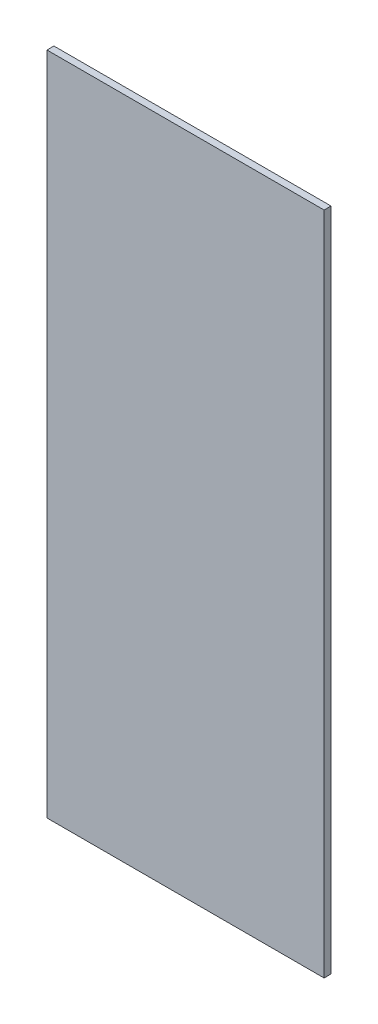
from build123d import *

# Parameters (mm, degrees)
SKETCH1_W           = 127
SKETCH1_H           = 304.8
BOSS_EXTRUDE1_DEPTH = 1.5875


with BuildPart() as part:
    # Sketch1 → Boss-Extrude1 (new, symmetric)
    with BuildSketch(Plane.XY):
        Rectangle(SKETCH1_W, SKETCH1_H)
    extrude(amount=BOSS_EXTRUDE1_DEPTH, both=True)


solid = part.part
